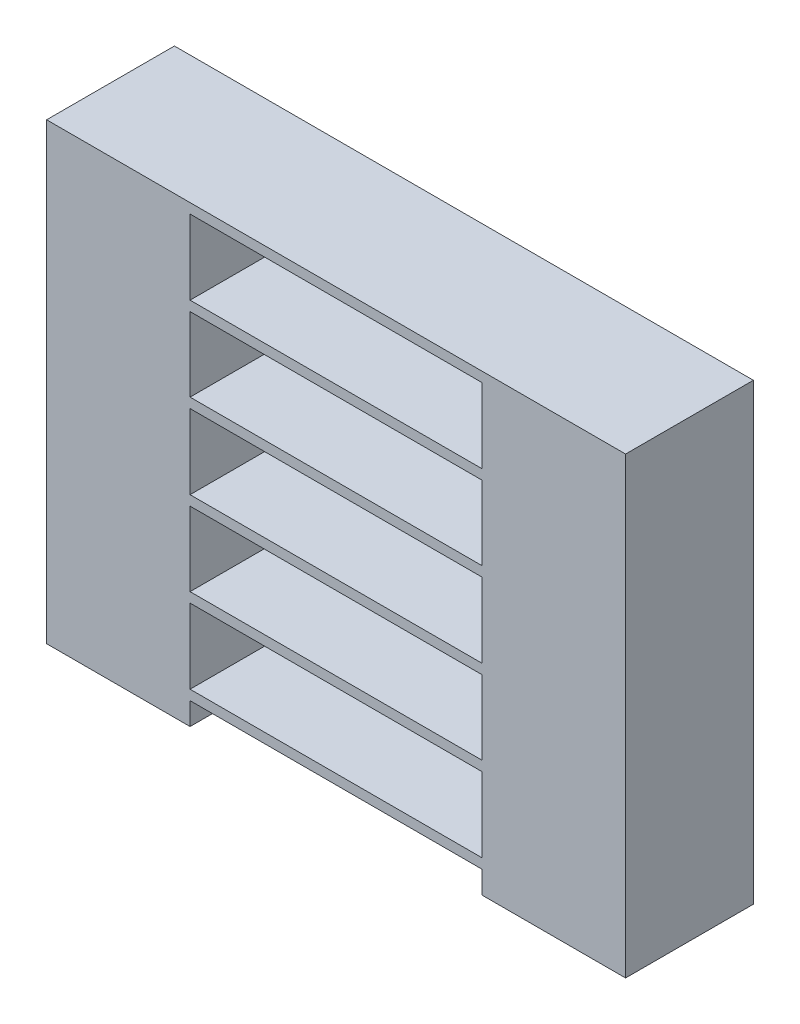
from build123d import *

# Parameters (mm, degrees)
SKETCH1_W           = 0.44
SKETCH1_H           = 1.74
BOSS_EXTRUDE1_DEPTH = 0.03
SKETCH2_W           = 0.44
SKETCH2_H           = 0.018
BOSS_EXTRUDE2_DEPTH = 1.16
SKETCH3_W           = 0.44
SKETCH3_H           = 1.74
BOSS_EXTRUDE3_DEPTH = 0.03
SKETCH4_W           = 1.22
SKETCH4_H           = 1.74
BOSS_EXTRUDE4_DEPTH = 0.03
THICK_IN_DEPTH      = 0.44
SKETCH6_W           = 1.12
SKETCH6_H           = 0.286
SKETCH6_H_2         = 0.284
BOSS_EXTRUDE5_DEPTH = 0.02
SKETCH7_W           = 0.49
SKETCH7_H           = 1.74
BOSS_EXTRUDE6_DEPTH = 0.5
SKETCH8_W           = 0.49
SKETCH8_H           = 1.74
BOSS_EXTRUDE7_DEPTH = 0.5


with BuildPart() as part:
    # Sketch1 → Boss-Extrude1 (new body)
    with BuildSketch(Plane(origin=(0, 0, 0), x_dir=(0, 0, -1), z_dir=(1, 0, 0))):
        Rectangle(SKETCH1_W, SKETCH1_H)
    extrude(amount=BOSS_EXTRUDE1_DEPTH)

    # Sketch2 → Boss-Extrude2 (add)
    with BuildSketch(Plane(origin=(0.03, 0, 0), x_dir=(0, 0, -1), z_dir=(1, 0, 0))):
        with Locations((0, -0.755)):
            Rectangle(SKETCH2_W, SKETCH2_H)
        with Locations((0, -0.431)):
            Rectangle(SKETCH2_W, SKETCH2_H)
        with Locations((0, -0.109)):
            Rectangle(SKETCH2_W, SKETCH2_H)
        with Locations((0, 0.215)):
            Rectangle(SKETCH2_W, SKETCH2_H)
        with Locations((0, 0.537)):
            Rectangle(SKETCH2_W, SKETCH2_H)
        with Locations((0, 0.861)):
            Rectangle(SKETCH2_W, SKETCH2_H)
    extrude(amount=BOSS_EXTRUDE2_DEPTH)

    # Sketch3 → Boss-Extrude3 (add)
    with BuildSketch(Plane(origin=(1.19, 0, 0), x_dir=(0, 0, -1), z_dir=(1, 0, 0))):
        Rectangle(SKETCH3_W, SKETCH3_H)
    extrude(amount=BOSS_EXTRUDE3_DEPTH)

    # Sketch4 → Boss-Extrude4 (add)
    with BuildSketch(Plane(origin=(0, 0, -0.22), x_dir=(-1, 0, 0), z_dir=(0, 0, -1))):
        with Locations((-0.61, 0)):
            Rectangle(SKETCH4_W, SKETCH4_H)
    extrude(amount=BOSS_EXTRUDE4_DEPTH)

    # Sketch5 → Thick in (add)
    with BuildSketch(Plane.XY.offset(-0.22)):
        Polygon((0.03, -0.87), (0.05, -0.87), (0.05, -0.784), (1.17, -0.784), (1.17, -0.87), (1.19, -0.87), (1.19, -0.764), (0.03, -0.764), align=None)
        Polygon((0.03, -0.746), (0.05, -0.746), (0.05, -0.726), (0.05, -0.46), (1.17, -0.46), (1.17, -0.726), (1.17, -0.746), (1.19, -0.746), (1.19, -0.44), (0.03, -0.44), align=None)
        Polygon((0.03, -0.422), (0.05, -0.422), (0.05, -0.402), (0.05, -0.138), (1.17, -0.138), (1.17, -0.402), (1.17, -0.422), (1.19, -0.422), (1.19, -0.118), (0.03, -0.118), align=None)
        Polygon((0.03, -0.1), (0.05, -0.1), (0.05, -0.08), (0.05, 0.186), (1.17, 0.186), (1.17, -0.08), (1.17, -0.1), (1.19, -0.1), (1.19, 0.206), (0.03, 0.206), align=None)
        Polygon((0.03, 0.224), (0.05, 0.224), (0.05, 0.244), (0.05, 0.508), (1.17, 0.508), (1.17, 0.244), (1.17, 0.224), (1.19, 0.224), (1.19, 0.528), (0.03, 0.528), align=None)
        Polygon((0.03, 0.546), (0.05, 0.546), (0.05, 0.566), (0.05, 0.832), (1.17, 0.832), (1.17, 0.566), (1.17, 0.546), (1.19, 0.546), (1.19, 0.852), (0.03, 0.852), align=None)
    extrude(amount=THICK_IN_DEPTH)

    # Sketch6 → Boss-Extrude5 (add)
    with BuildSketch(Plane.XY.offset(0.22)):
        Polygon((0, -0.87), (0.05, -0.87), (0.05, -0.784), (1.17, -0.784), (1.17, -0.87), (1.22, -0.87), (1.22, 0.87), (0, 0.87), align=None)
        with Locations((0.61, 0.689)):
            Rectangle(SKETCH6_W, SKETCH6_H, mode=Mode.SUBTRACT)
        with Locations((0.61, 0.366)):
            Rectangle(SKETCH6_W, SKETCH6_H_2, mode=Mode.SUBTRACT)
        with Locations((0.61, 0.043)):
            Rectangle(SKETCH6_W, SKETCH6_H, mode=Mode.SUBTRACT)
        with Locations((0.61, -0.28)):
            Rectangle(SKETCH6_W, SKETCH6_H_2, mode=Mode.SUBTRACT)
        with Locations((0.61, -0.603)):
            Rectangle(SKETCH6_W, SKETCH6_H, mode=Mode.SUBTRACT)
    extrude(amount=BOSS_EXTRUDE5_DEPTH)

    # Sketch7 → Boss-Extrude6 (add)
    with BuildSketch(Plane(origin=(1.22, 0, 0), x_dir=(0, 0, -1), z_dir=(1, 0, 0))):
        with Locations((0.005, 0)):
            Rectangle(SKETCH7_W, SKETCH7_H)
    extrude(amount=BOSS_EXTRUDE6_DEPTH)

    # Sketch8 → Boss-Extrude7 (add)
    with BuildSketch(Plane.ZY):
        with Locations((-0.005, 0)):
            Rectangle(SKETCH8_W, SKETCH8_H)
    extrude(amount=BOSS_EXTRUDE7_DEPTH)


solid = part.part
